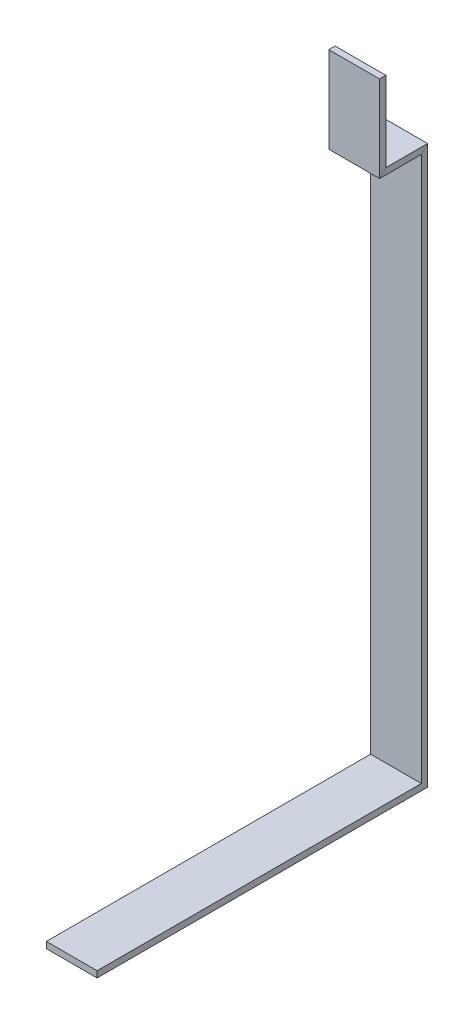
from build123d import *

# Parameters (mm, degrees)
CROQUIS1_W              = 50.8
CROQUIS1_H              = 6.31
SALIENTE_EXTRUIR1_DEPTH = 330.7
CROQUIS3_W              = 50.8
CROQUIS3_H              = 6.31
SALIENTE_EXTRUIR2_DEPTH = 544.51
CROQUIS4_W              = 50.8
CROQUIS4_H              = 6.31


with BuildPart() as part:
    # Croquis1 → Saliente-Extruir1 (new body)
    with BuildSketch(Plane.XY):
        Rectangle(CROQUIS1_W, CROQUIS1_H)
    extrude(amount=SALIENTE_EXTRUIR1_DEPTH)

    # Croquis3 → Saliente-Extruir2 (add)
    with BuildSketch(Plane.XZ.offset(3.155)):
        with Locations((0, 3.155)):
            Rectangle(CROQUIS3_W, CROQUIS3_H)
    extrude(amount=-SALIENTE_EXTRUIR2_DEPTH)

    # Barrer1: sweep along a curve in space
    with BuildLine() as barrer1_path:
        Line((0, 541.355, 3.155), (0, 551.355, 3.155))
        Line((0, 551.355, 3.155), (0, 551.355, 44.965))
        Line((0, 551.355, 44.965), (0, 634.515, 44.965))
    # Croquis4 → Barrer1 (sweep)
    with BuildSketch(Plane(origin=(0, 541.355, 0), x_dir=(1, 0, 0), z_dir=(0, 1, 0))):
        with Locations((0, -3.155)):
            Rectangle(CROQUIS4_W, CROQUIS4_H)
    sweep(path=barrer1_path.line, transition=Transition.RIGHT)


solid = part.part
